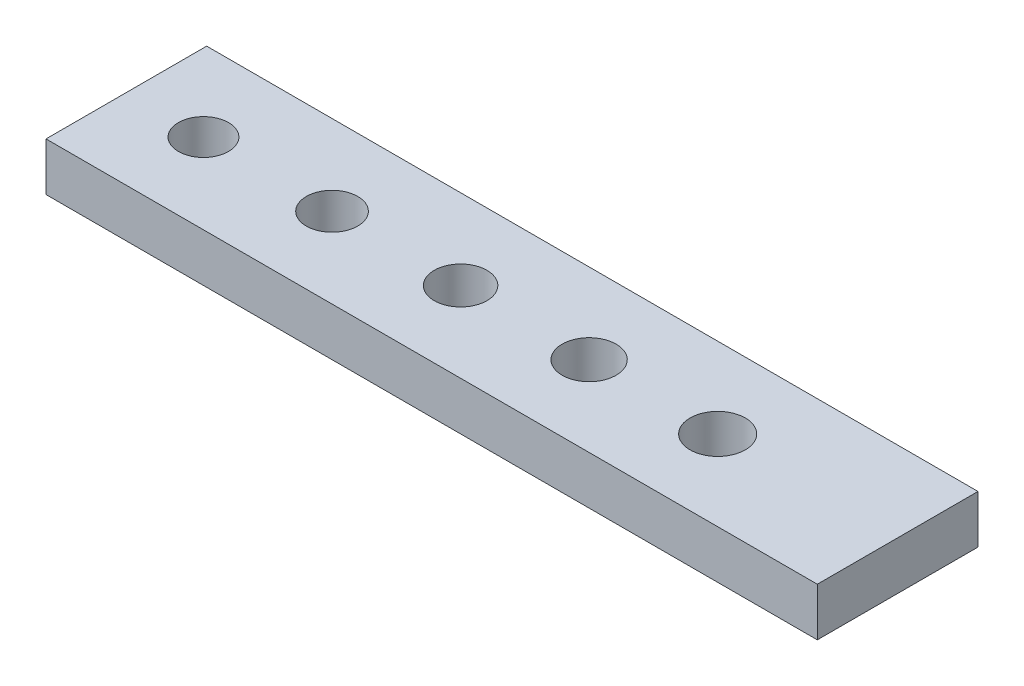
from build123d import *

# Parameters (mm, degrees)
SKETCH1_W           = 30.48
SKETCH1_H           = 6.35
SKETCH1_R           = 0.9906
SKETCH1_R_2         = 1.016
SKETCH1_R_3         = 1.0414
SKETCH1_R_4         = 1.0668
SKETCH1_R_5         = 1.0922
BOSS_EXTRUDE1_DEPTH = 1.905


with BuildPart() as part:
    # Sketch1 → Boss-Extrude1 (new body)
    with BuildSketch(Plane(origin=(0, 0, 0), x_dir=(1, 0, 0), z_dir=(0, 1, 0))):
        with Locations((-15.24, -3.175)):
            Rectangle(SKETCH1_W, SKETCH1_H)
        with Locations(Location((-27.432, -3.175, 0), (0, 0, 90))):
            Circle(SKETCH1_R, mode=Mode.SUBTRACT)
        with Locations(Location((-22.352, -3.175, 0), (0, 0, 90))):
            Circle(SKETCH1_R_2, mode=Mode.SUBTRACT)
        with Locations(Location((-17.272, -3.175, 0), (0, 0, 90))):
            Circle(SKETCH1_R_3, mode=Mode.SUBTRACT)
        with Locations(Location((-12.192, -3.175, 0), (0, 0, 90))):
            Circle(SKETCH1_R_4, mode=Mode.SUBTRACT)
        with Locations(Location((-7.112, -3.175, 0), (0, 0, 90))):
            Circle(SKETCH1_R_5, mode=Mode.SUBTRACT)
    extrude(amount=BOSS_EXTRUDE1_DEPTH)


solid = part.part
